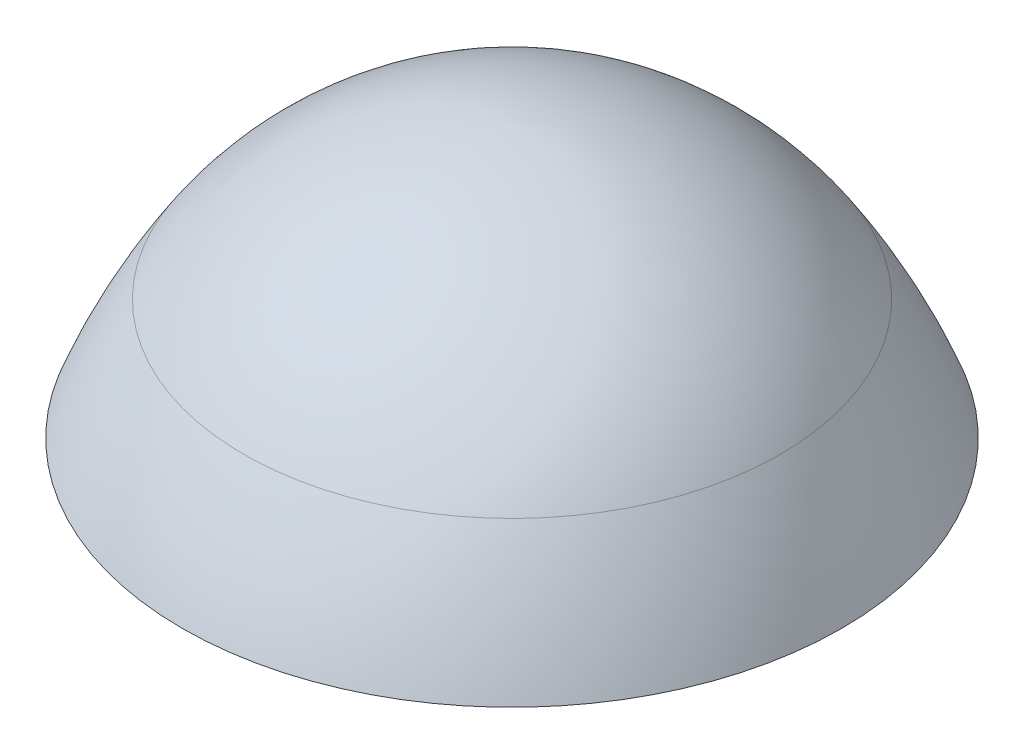
from build123d import *

# Parameters (mm, degrees)
SHELL1_T = -2


with BuildPart() as part:
    # Sketch4 → Revolve1 (revolve)
    with BuildSketch(Plane(origin=(0, 0, 0), x_dir=(0, 0, -1), z_dir=(1, 0, 0)), mode=Mode.PRIVATE) as revolve1_sk:
        with BuildLine():
            Line((0, 0), (-4.5, 0))
            ThreePointArc((-4.5, 0), (-4.12520214, 0.842444115), (-3.663849207, 1.640779253))
            ThreePointArc((-3.663849207, 1.640779253), (-2.085005391, 3.120681244), (0, 3.7))
            Line((0, 3.7), (0, 0))
        make_face()
    revolve(revolve1_sk.sketch.rotate(Axis((0, 0, 0), (0, 1, 0)), 180), axis=Axis((0, 0, 0), (0, 1, 0)))

    # Shell1
    shell1_openings = [part.faces().sort_by_distance(p)[0] for p in [
        (0, 0, 0),
    ]]
    offset(amount=SHELL1_T, openings=shell1_openings, kind=Kind.INTERSECTION)


solid = part.part
